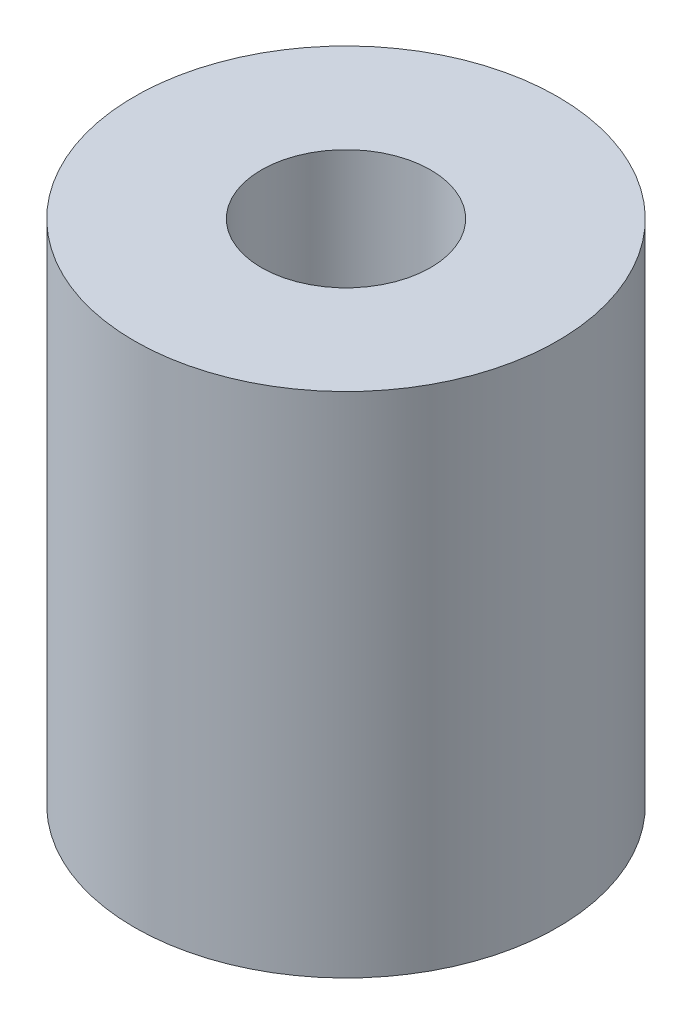
from build123d import *

# Parameters (mm, degrees)
SKETCH1_R           = 5
SKETCH1_R_2         = 2
BOSS_EXTRUDE1_DEPTH = 12


with BuildPart() as part:
    # Sketch1 → Boss-Extrude1 (new body)
    with BuildSketch(Plane(origin=(0, 0, 0), x_dir=(1, 0, 0), z_dir=(0, 1, 0))):
        with Locations(Location((0, 0, 0), (0, 0, 270))):
            Circle(SKETCH1_R)
        with Locations(Location((0, 0, 0), (0, 0, 270))):
            Circle(SKETCH1_R_2, mode=Mode.SUBTRACT)
    extrude(amount=BOSS_EXTRUDE1_DEPTH)


solid = part.part
